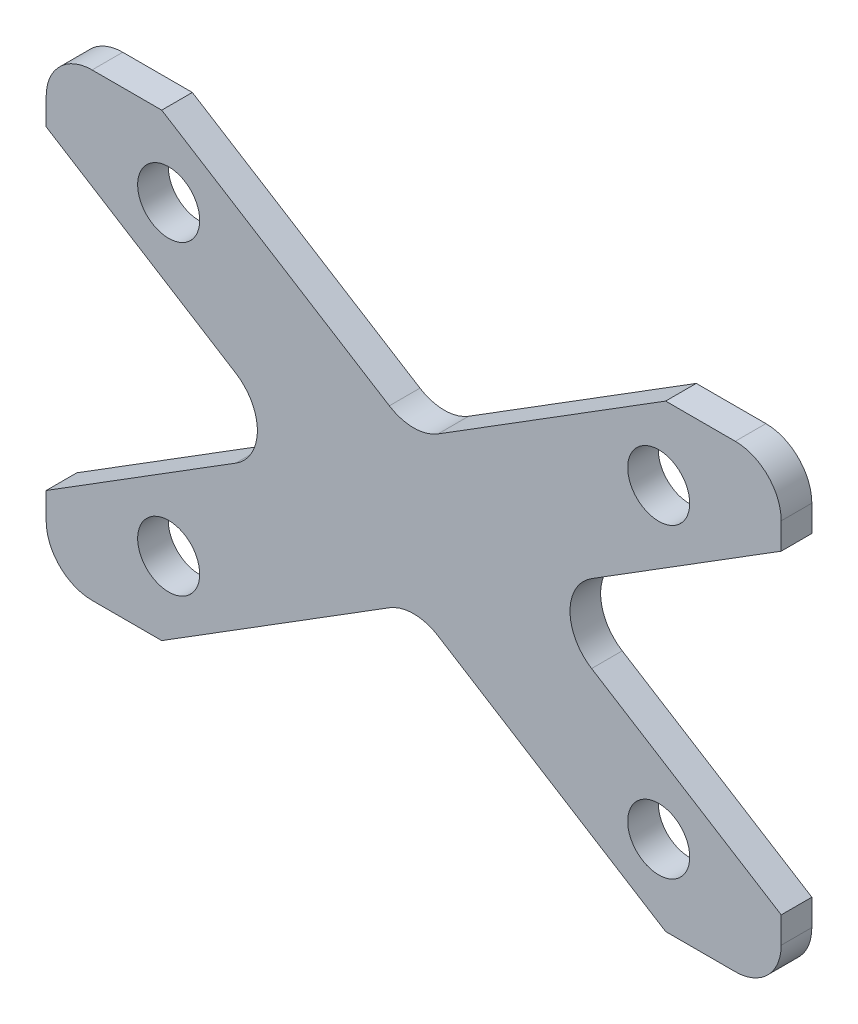
from build123d import *

# Parameters (mm, degrees)
SKETCH1_R           = 2.025
BOSS_EXTRUDE1_DEPTH = 2
FILLET1_R           = 3


with BuildPart() as part:
    # Sketch1 → Boss-Extrude1 (new body)
    with BuildSketch(Plane.XY):
        Polygon((-24, 15), (-16.452815094, 15), (0, 4.716990566), (16.452815094, 15), (24, 15), (24, 10.283009434), (7.547184906, 0), (24, -10.283009434), (24, -15), (16.452815094, -15), (0, -4.716990566), (-16.452815094, -15), (-24, -15), (-24, -10.283009434), (-7.547184906, 0), (-24, 10.283009434), align=None)
        with Locations((-16, 10)):
            Circle(SKETCH1_R, mode=Mode.SUBTRACT)
        with Locations((16, 10)):
            Circle(SKETCH1_R, mode=Mode.SUBTRACT)
        with Locations((16, -10)):
            Circle(SKETCH1_R, mode=Mode.SUBTRACT)
        with Locations((-16, -10)):
            Circle(SKETCH1_R, mode=Mode.SUBTRACT)
    extrude(amount=BOSS_EXTRUDE1_DEPTH)

    # Fillet1
    fillet1_edges = [part.edges().sort_by_distance(p)[0] for p in [
        (24, -15, 1),
        (0, -4.716990566, 1),
        (-24, -15, 1),
        (-7.547184906, 0, 1),
        (-24, 15, 1),
        (0, 4.716990566, 1),
        (24, 15, 1),
        (7.547184906, 0, 1),
    ]]
    fillet(fillet1_edges, radius=FILLET1_R)


solid = part.part
